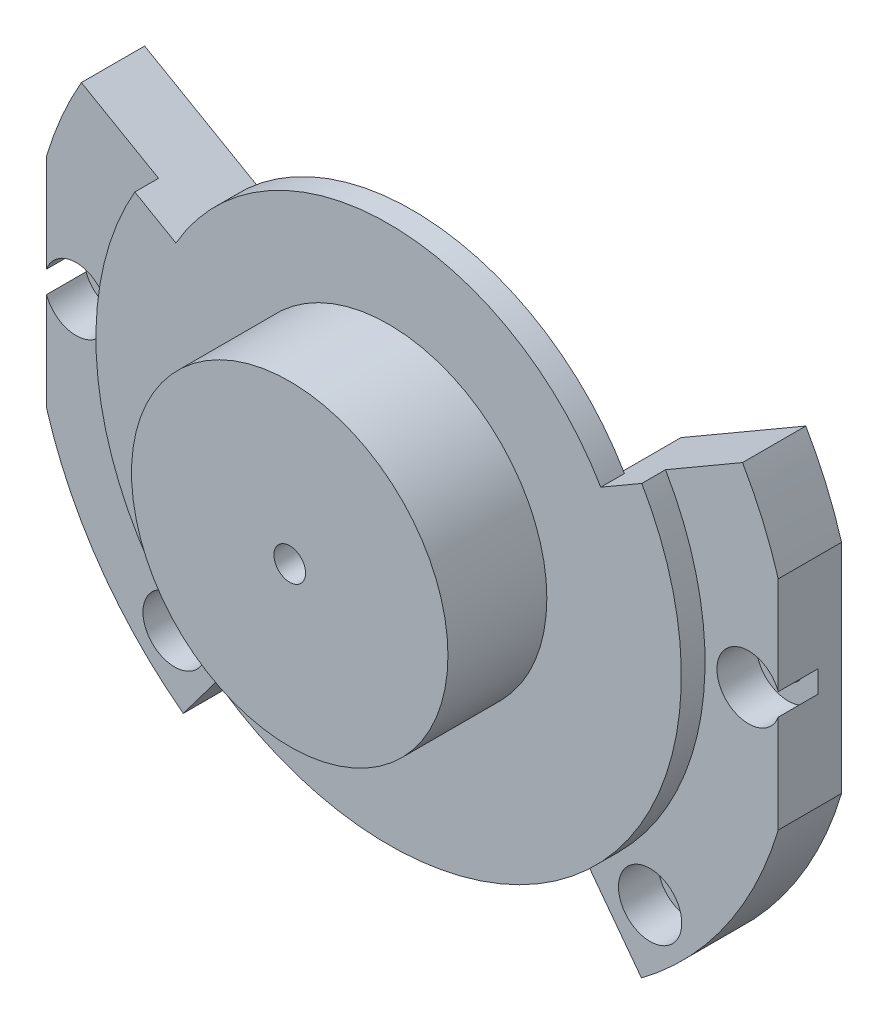
from build123d import *

# Parameters (mm, degrees)
SKETCH1_R           = 48.25
BOSS_EXTRUDE1_DEPTH = 8
SKETCH2_W           = 17.162038191
SKETCH2_H           = 56.822210482
SKETCH2_W_2         = 16.152506533
SKETCH2_H_2         = 65.186901365
CUT_EXTRUDE1_DEPTH  = 8
SKETCH3_R           = 30
CUT_EXTRUDE2_DEPTH  = 8
SKETCH4_R           = 1.75
CUT_EXTRUDE3_DEPTH  = 10
CIRPATTERN1_COUNT   = 8
CUT_EXTRUDE4_DEPTH  = 10
CIRPATTERN2_COUNT   = 2
SKETCH9_R           = 4
CUT_EXTRUDE5_DEPTH  = 5
CIRPATTERN3_COUNT   = 8
SKETCH10_R          = 4
CUT_EXTRUDE6_DEPTH  = 5
SKETCH11_R          = 37
BOSS_EXTRUDE2_DEPTH = 3
SKETCH12_R          = 20
BOSS_EXTRUDE3_DEPTH = 12.5
SKETCH13_R          = 2
CUT_EXTRUDE8_DEPTH  = 38
CUT_EXTRUDE9_DEPTH  = 4
CUT_EXTRUDE10_DEPTH = 10
CUT_EXTRUDE11_START = 14
CUT_EXTRUDE11_DEPTH = 14


with BuildPart() as part:
    # Sketch1 → Boss-Extrude1 (new body)
    with BuildSketch(Plane.XY):
        Circle(SKETCH1_R)
    extrude(amount=-BOSS_EXTRUDE1_DEPTH)

    # Sketch2 → Cut-Extrude1 (cut)
    with BuildSketch(Plane.XY):
        with Locations((-54.831019095, 0)):
            Rectangle(SKETCH2_W, SKETCH2_H)
        with Locations((54.326253267, -4.182345442)):
            Rectangle(SKETCH2_W_2, SKETCH2_H_2)
    extrude(amount=-CUT_EXTRUDE1_DEPTH, mode=Mode.SUBTRACT)

    # Sketch3 → Cut-Extrude2 (cut)
    with BuildSketch(Plane.XY):
        Circle(SKETCH3_R)
    extrude(amount=-CUT_EXTRUDE2_DEPTH, mode=Mode.SUBTRACT)

    # Sketch4 → Cut-Extrude3 (cut)
    with BuildSketch(Plane.XY):
        with Locations((-42.5, 0)):
            Circle(SKETCH4_R)
    cut_extrude3 = extrude(amount=-CUT_EXTRUDE3_DEPTH, mode=Mode.SUBTRACT)

    # CirPattern1: Cut-Extrude3 ×8 about axis
    cirpattern1_axis = Axis((0, 0, 0), (0, 0, 1))
    for i in range(1, CIRPATTERN1_COUNT):
        add(cut_extrude3.rotate(cirpattern1_axis, i * 360 / CIRPATTERN1_COUNT), mode=Mode.SUBTRACT)

    # Sketch8 → Cut-Extrude4 (cut)
    with BuildSketch(Plane.XY):
        with BuildLine():
            Line((-28.959547499, 38.59283753), (0, 0))
            Line((0, 0), (28.959547499, 38.59283753))
            ThreePointArc((28.959547499, 38.59283753), (0, 48.25), (-28.959547499, 38.59283753))
        make_face()
    cut_extrude4 = extrude(amount=-CUT_EXTRUDE4_DEPTH, mode=Mode.SUBTRACT)

    # CirPattern2: Cut-Extrude4 ×2 about axis
    cirpattern2_axis = Axis((0, 0, 0), (0, 0, 1))
    for i in range(1, CIRPATTERN2_COUNT):
        add(cut_extrude4.rotate(cirpattern2_axis, i * 360 / CIRPATTERN2_COUNT), mode=Mode.SUBTRACT)

    # Sketch9 → Cut-Extrude5 (cut)
    with BuildSketch(Plane.XY):
        with Locations((-42.5, 0)):
            Circle(SKETCH9_R)
    cut_extrude5 = extrude(amount=-CUT_EXTRUDE5_DEPTH, mode=Mode.SUBTRACT)

    # CirPattern3: Cut-Extrude5 ×8 about axis, 3 skipped
    cirpattern3_axis = Axis((0, 0, 0), (0, 0, 1))
    add([cut_extrude5.rotate(cirpattern3_axis, i * 360 / CIRPATTERN3_COUNT) for i in range(1, CIRPATTERN3_COUNT) if i not in (3, 4, 5)], mode=Mode.SUBTRACT)

    # Sketch10 → Cut-Extrude6 (cut)
    with BuildSketch(Plane.XY):
        with Locations((42.5, 0)):
            Circle(SKETCH10_R)
        with Locations((30.0520382, 30.0520382)):
            Circle(SKETCH10_R)
        with Locations((30.0520382, -30.0520382)):
            Circle(SKETCH10_R)
    extrude(amount=-CUT_EXTRUDE6_DEPTH, mode=Mode.SUBTRACT)

    # Sketch11 → Boss-Extrude2 (add)
    with BuildSketch(Plane.XY):
        with Locations(Location((0, 0, 0), (0, 0, 126.884070759))):
            Circle(SKETCH11_R)
    extrude(amount=BOSS_EXTRUDE2_DEPTH)

    # Sketch12 → Boss-Extrude3 (add)
    with BuildSketch(Plane.XY.offset(3)):
        Circle(SKETCH12_R)
    extrude(amount=BOSS_EXTRUDE3_DEPTH)

    # Sketch13 → Cut-Extrude8 (cut)
    with BuildSketch(Plane.XY.offset(15.5)):
        Circle(SKETCH13_R)
    extrude(amount=-CUT_EXTRUDE8_DEPTH, mode=Mode.SUBTRACT)

    # Sketch14 → Cut-Extrude9 (cut)
    with BuildSketch(Plane(origin=(0, 0, 0), x_dir=(-1, 0, 0), z_dir=(0, 0, -1))):
        Polygon((-2.020725942, -3.5), (2.020725942, -3.5), (4.041451884, 0), (2.020725942, 3.5), (-2.020725942, 3.5), (-4.041451884, 0), align=None)
    extrude(amount=-CUT_EXTRUDE9_DEPTH, mode=Mode.SUBTRACT)

    # Sketch15 → Cut-Extrude10 (cut)
    with BuildSketch(Plane.XY):
        with BuildLine():
            Line((-41.839011718, 24.03246967), (0, 0))
            Line((0, 0), (41.732235109, 24.217412182))
            ThreePointArc((41.732235109, 24.217412182), (-0.106776609, 48.249881852), (-41.839011718, 24.03246967))
        make_face()
    extrude(amount=-CUT_EXTRUDE10_DEPTH, mode=Mode.SUBTRACT)

    # Sketch16 → Cut-Extrude11 (cut)
    with BuildSketch(Plane.XY.offset(CUT_EXTRUDE11_START)):
        with BuildLine():
            Line((-41.839011718, 24.03246967), (-26.881023073, 15.440550462))
            ThreePointArc((-26.881023073, 15.440550462), (-0.068602588, 30.999924092), (26.812420485, 15.55937363))
            Line((26.812420485, 15.55937363), (41.732235109, 24.217412182))
            ThreePointArc((41.732235109, 24.217412182), (-0.106776609, 48.249881852), (-41.839011718, 24.03246967))
        make_face()
    extrude(amount=-CUT_EXTRUDE11_DEPTH, mode=Mode.SUBTRACT)


solid = part.part
